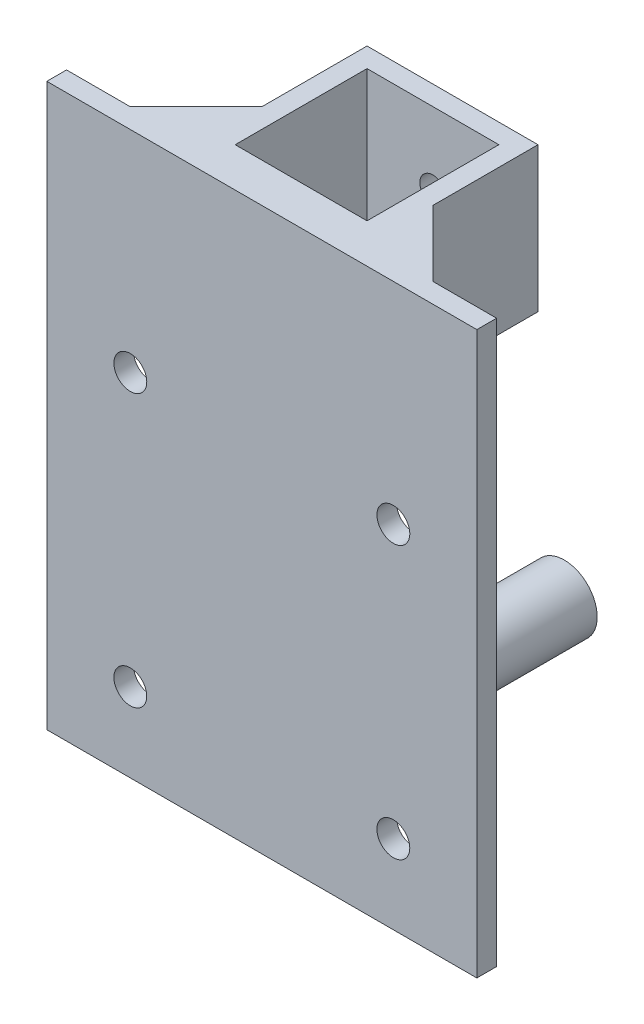
from build123d import *

# Parameters (mm, degrees)
SKETCH_1_W             = 65.4
SKETCH_1_H             = 85.4
SKETCH_1_R             = 2.5
EXTRUDE_632_DEPTH      = 3
SKETCH_2_W             = 26
SKETCH_2_H             = 22
EXTRUDE_871_DEPTH      = 26
SKETCH_3_W             = 20.05
SKETCH_3_H             = 20.05
CUT_EXTRUDE_1082_DEPTH = 95.724442463
SKETCH_8_R             = 5.872551453
EXTRUDE_1_DEPTH        = 14.4
SKETCH_4_R             = 2
EXTRUDE_3_DEPTH        = 14.4
SKETCH_12_R            = 5
EXTRUDE_5_DEPTH        = 21
SKETCH_13_R            = 2
CUT_EXTRUDE_1_DEPTH    = 6.6
SKETCH_14_R            = 2
CUT_EXTRUDE_3_DEPTH    = 8
CHAMFER_1_SIZE         = 10
CHAMFER_2_SIZE         = 10
SKETCH_15_R            = 2
CUT_EXTRUDE_4_DEPTH    = 8


with BuildPart() as part:
    # Эскиз1 → Extrude 632 (new body)
    with BuildSketch(Plane.XY):
        with Locations((-32.7, 42.7)):
            Rectangle(SKETCH_1_W, SKETCH_1_H)
        with Locations((-52.7, 53.4)):
            Circle(SKETCH_1_R, mode=Mode.SUBTRACT)
        with Locations(Location((-12.7, 53.4, 0), (0, 0, 180))):
            Circle(SKETCH_1_R, mode=Mode.SUBTRACT)
        with Locations((-12.7, 12)):
            Circle(SKETCH_1_R, mode=Mode.SUBTRACT)
        with Locations(Location((-52.7, 12, 0), (0, 0, 180))):
            Circle(SKETCH_1_R, mode=Mode.SUBTRACT)
    extrude(amount=EXTRUDE_632_DEPTH)

    # Эскиз2 → Extrude 871 (add)
    with BuildSketch(Plane(origin=(0, 0, 0), x_dir=(-1, 0, 0), z_dir=(0, 0, -1))):
        with Locations((32.7, 74.4)):
            Rectangle(SKETCH_2_W, SKETCH_2_H)
    extrude(amount=EXTRUDE_871_DEPTH)

    # Эскиз3 → Cut-Extrude 1082 (cut, through all)
    with BuildSketch(Plane.XZ.offset(-63.4)):
        with Locations((-32.7, -13)):
            Rectangle(SKETCH_3_W, SKETCH_3_H)
    extrude(amount=-CUT_EXTRUDE_1082_DEPTH, mode=Mode.SUBTRACT)

    # Эскиз8 → Бобышка-Вытянуть1 (add)
    with BuildSketch(Plane(origin=(0, 0, 0), x_dir=(-1, 0, 0), z_dir=(0, 0, -1))):
        with Locations(Location((54.7, 32.7, 0), (0, 0, 180))):
            Circle(SKETCH_8_R)
    extrude(amount=EXTRUDE_1_DEPTH)

    # Эскиз4 → Бобышка-Вытянуть3 (add)
    with BuildSketch(Plane(origin=(0, 0, 0), x_dir=(-1, 0, 0), z_dir=(0, 0, -1))):
        with Locations((52.7, 32.7)):
            Circle(SKETCH_4_R)
    extrude(amount=EXTRUDE_3_DEPTH)

    # Эскиз12 → Бобышка-Вытянуть5 (add)
    with BuildSketch(Plane(origin=(0, 0, 0), x_dir=(-1, 0, 0), z_dir=(0, 0, -1))):
        with Locations(Location((10.7, 32.7, 0), (0, 0, 180))):
            Circle(SKETCH_12_R)
    extrude(amount=EXTRUDE_5_DEPTH)

    # Эскиз13 → Вырез-Вытянуть1 (cut)
    with BuildSketch(Plane(origin=(0, 0, -21), x_dir=(-1, 0, 0), z_dir=(0, 0, -1))):
        with Locations((10.7, 32.7)):
            Circle(SKETCH_13_R)
    extrude(amount=-CUT_EXTRUDE_1_DEPTH, mode=Mode.SUBTRACT)

    # Эскиз14 → Вырез-Вытянуть3 (cut)
    with BuildSketch(Plane(origin=(0, 0, -14.4), x_dir=(-1, 0, 0), z_dir=(0, 0, -1))):
        with Locations((54.7, 32.7)):
            Circle(SKETCH_14_R)
    extrude(amount=-CUT_EXTRUDE_3_DEPTH, mode=Mode.SUBTRACT)

    # Фаска1
    chamfer_1_edges = [part.edges().sort_by_distance(p)[0] for p in [
        (-45.7, 74.4, 0),
    ]]
    chamfer(chamfer_1_edges, length=CHAMFER_1_SIZE)

    # Фаска2
    chamfer_2_edges = [part.edges().sort_by_distance(p)[0] for p in [
        (-19.7, 74.4, 0),
    ]]
    chamfer(chamfer_2_edges, length=CHAMFER_2_SIZE)

    # Эскиз15 → Вырез-Вытянуть4 (cut)
    with BuildSketch(Plane(origin=(0, 0, -26), x_dir=(-1, 0, 0), z_dir=(0, 0, -1))):
        with Locations((32.7, 74.4)):
            Circle(SKETCH_15_R)
    extrude(amount=-CUT_EXTRUDE_4_DEPTH, mode=Mode.SUBTRACT)


solid = part.part
